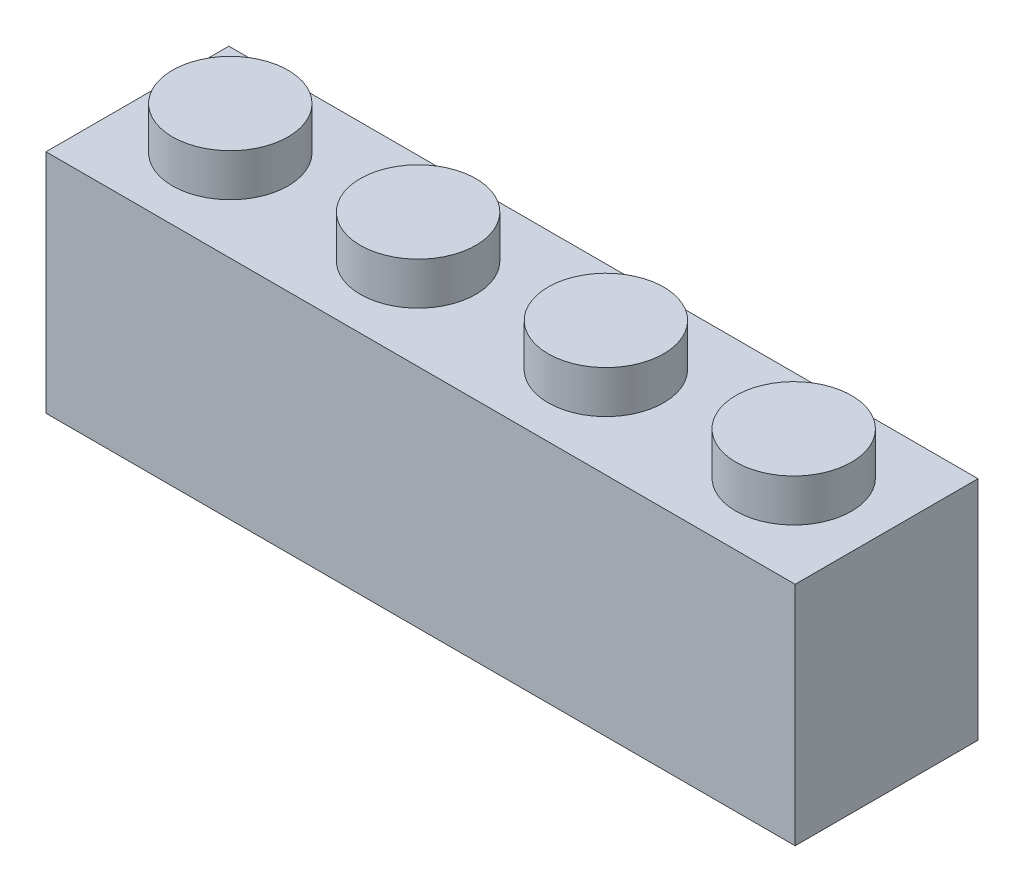
from build123d import *

# Parameters (mm, degrees)
SKETCH1_W           = 31.75
SKETCH1_H           = 7.75
BOSS_EXTRUDE1_DEPTH = 9.6
SKETCH2_R           = 2.45
BOSS_EXTRUDE2_DEPTH = 1.8
SHELL1_T            = -1.5


with BuildPart() as part:
    # Sketch1 → Boss-Extrude1 (new body)
    with BuildSketch(Plane(origin=(0, 0, 0), x_dir=(1, 0, 0), z_dir=(0, 1, 0))):
        Rectangle(SKETCH1_W, SKETCH1_H)
    extrude(amount=-BOSS_EXTRUDE1_DEPTH)

    # Sketch2 → Boss-Extrude2 (add)
    with BuildSketch(Plane(origin=(0, 0, 0), x_dir=(1, 0, 0), z_dir=(0, 1, 0))):
        with Locations(Location((-11.94, 0, 0), (0, 0, 270))):
            Circle(SKETCH2_R)
        with Locations(Location((-3.98, 0, 0), (0, 0, 270))):
            Circle(SKETCH2_R)
        with Locations(Location((3.98, 0, 0), (0, 0, 270))):
            Circle(SKETCH2_R)
        with Locations(Location((11.94, 0, 0), (0, 0, 270))):
            Circle(SKETCH2_R)
    extrude(amount=BOSS_EXTRUDE2_DEPTH)

    # Shell1
    shell1_openings = [part.faces().sort_by_distance(p)[0] for p in [
        (0, -9.6, 0),
    ]]
    offset(amount=SHELL1_T, openings=shell1_openings, kind=Kind.INTERSECTION)


solid = part.part
